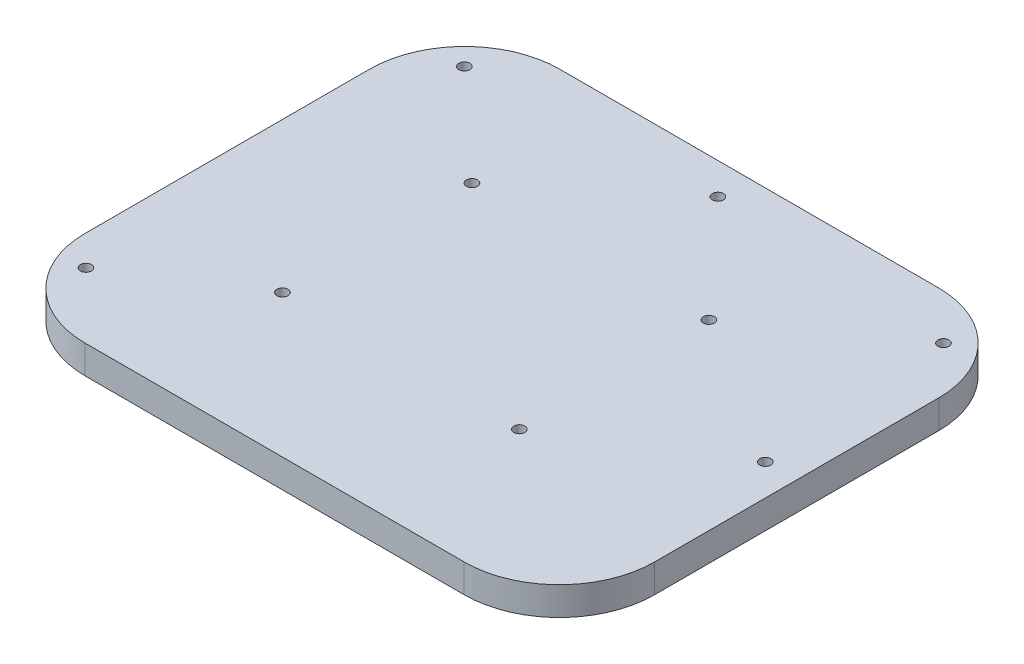
from build123d import *

# Parameters (mm, degrees)
BOSS_EXTRUDE1_DEPTH = 6
SKETCH2_R           = 1.25
CUT_EXTRUDE1_DEPTH  = 79.33262411
SKETCH3_R           = 1.25
CUT_EXTRUDE2_DEPTH  = 79.33262411
MOVE_FACE1_BY       = 0.08
MOVE_FACE1_2_BY     = 0.08
MOVE_FACE1_3_BY     = 0.08
MOVE_FACE1_4_BY     = 0.08
MOVE_FACE1_5_BY     = 0.08
MOVE_FACE1_6_BY     = 0.08
MOVE_FACE1_7_BY     = 0.08
MOVE_FACE1_8_BY     = 0.08
MOVE_FACE1_9_BY     = 0.08
MOVE_FACE1_10_BY    = 0.08
MOVE_FACE1_11_BY    = 0.08
MOVE_FACE1_12_BY    = 0.08
MOVE_FACE1_13_BY    = 0.08
MOVE_FACE1_14_BY    = 0.08
MOVE_FACE1_15_BY    = 0.08
MOVE_FACE1_16_BY    = 0.08
MOVE_FACE1_17_BY    = 0.08


with BuildPart() as part:
    # Sketch1 → Boss-Extrude1 (new body)
    with BuildSketch(Plane(origin=(0, 0, 0), x_dir=(1, 0, 0), z_dir=(0, 1, 0))):
        with BuildLine():
            Line((-60, 30), (-60, -30))
            ThreePointArc((-60, -30), (-54.142135624, -44.142135624), (-40, -50))
            Line((-40, -50), (40, -50))
            ThreePointArc((40, -50), (54.142135624, -44.142135624), (60, -30))
            Line((60, -30), (60, 30))
            ThreePointArc((60, 30), (54.142135624, 44.142135624), (40, 50))
            Line((40, 50), (-40, 50))
            ThreePointArc((-40, 50), (-54.142135624, 44.142135624), (-60, 30))
        make_face()
    extrude(amount=BOSS_EXTRUDE1_DEPTH)

    # Sketch2 → Cut-Extrude1 (cut, through all)
    with BuildSketch(Plane(origin=(0, 6, 0), x_dir=(1, 0, 0), z_dir=(0, 1, 0))):
        with Locations(Location((53.475, 0, 0), (0, 0, 270))):
            Circle(SKETCH2_R)
        with Locations(Location((-53.709292606, -36.227375296, 0), (0, 0, 270))):
            Circle(SKETCH2_R)
        with Locations(Location((0, 43.45, 0), (0, 0, 270))):
            Circle(SKETCH2_R)
        with Locations(Location((50.560271927, 40.506415982, 0), (0, 0, 270))):
            Circle(SKETCH2_R)
        with Locations(Location((-50.558556763, 40.508556763, 0), (0, 0, 90))):
            Circle(SKETCH2_R)
    extrude(amount=-CUT_EXTRUDE1_DEPTH, mode=Mode.SUBTRACT)

    # Sketch3 → Cut-Extrude2 (cut, through all)
    with BuildSketch(Plane(origin=(0, 6, 0), x_dir=(1, 0, 0), z_dir=(0, 1, 0))):
        with Locations(Location((-28.45, 20, 0), (0, 0, 270))):
            Circle(SKETCH3_R)
        with Locations(Location((21.55, 20, 0), (0, 0, 270))):
            Circle(SKETCH3_R)
        with Locations(Location((-28.45, -20, 0), (0, 0, 270))):
            Circle(SKETCH3_R)
        with Locations(Location((21.55, -20, 0), (0, 0, 270))):
            Circle(SKETCH3_R)
    extrude(amount=-CUT_EXTRUDE2_DEPTH, mode=Mode.SUBTRACT)

    # Move Face1: a curved face moved outward by 0.08
    add(Solid.thicken(part.faces().sort_by_distance((21.55, 3, 18.75))[0], MOVE_FACE1_BY))

    # Move Face1 2: a curved face moved outward by 0.08
    add(Solid.thicken(part.faces().sort_by_distance((54.142135624, 3, 44.142135624))[0], MOVE_FACE1_2_BY))

    # Move Face1 3: a face moved outward by 0.08
    extrude(part.faces().sort_by_distance((60, 3, 0))[0], amount=MOVE_FACE1_3_BY, dir=(1, 0, 0))

    # Move Face1 4: a curved face moved outward by 0.08
    add(Solid.thicken(part.faces().sort_by_distance((54.142135624, 3, -44.142135624))[0], MOVE_FACE1_4_BY))

    # Move Face1 5: a face moved outward by 0.08
    extrude(part.faces().sort_by_distance((0, 3, -50))[0], amount=MOVE_FACE1_5_BY, dir=(0, 0, -1))

    # Move Face1 6: a curved face moved outward by 0.08
    add(Solid.thicken(part.faces().sort_by_distance((-54.142135624, 3, -44.142135624))[0], MOVE_FACE1_6_BY))

    # Move Face1 7: a face moved outward by 0.08
    extrude(part.faces().sort_by_distance((-60, 3, 0))[0], amount=MOVE_FACE1_7_BY, dir=(-1, 0, 0))

    # Move Face1 8: a curved face moved outward by 0.08
    add(Solid.thicken(part.faces().sort_by_distance((-54.142135624, 3, 44.142135624))[0], MOVE_FACE1_8_BY))

    # Move Face1 9: a face moved outward by 0.08
    extrude(part.faces().sort_by_distance((0, 3, 50))[0], amount=MOVE_FACE1_9_BY, dir=(0, 0, 1))

    # Move Face1 10: a curved face moved outward by 0.08
    add(Solid.thicken(part.faces().sort_by_distance((53.475, 3, -1.25))[0], MOVE_FACE1_10_BY))

    # Move Face1 11: a curved face moved outward by 0.08
    add(Solid.thicken(part.faces().sort_by_distance((0, 3, -44.7))[0], MOVE_FACE1_11_BY))

    # Move Face1 12: a curved face moved outward by 0.08
    add(Solid.thicken(part.faces().sort_by_distance((50.560271927, 3, -41.756415982))[0], MOVE_FACE1_12_BY))

    # Move Face1 13: a curved face moved outward by 0.08
    add(Solid.thicken(part.faces().sort_by_distance((-50.558556763, 3, -39.258556763))[0], MOVE_FACE1_13_BY))

    # Move Face1 14: a curved face moved outward by 0.08
    add(Solid.thicken(part.faces().sort_by_distance((-53.709292606, 3, 34.977375296))[0], MOVE_FACE1_14_BY))

    # Move Face1 15: a curved face moved outward by 0.08
    add(Solid.thicken(part.faces().sort_by_distance((-28.45, 3, -21.25))[0], MOVE_FACE1_15_BY))

    # Move Face1 16: a curved face moved outward by 0.08
    add(Solid.thicken(part.faces().sort_by_distance((21.55, 3, -21.25))[0], MOVE_FACE1_16_BY))

    # Move Face1 17: a curved face moved outward by 0.08
    add(Solid.thicken(part.faces().sort_by_distance((-28.45, 3, 18.75))[0], MOVE_FACE1_17_BY))


solid = part.part
